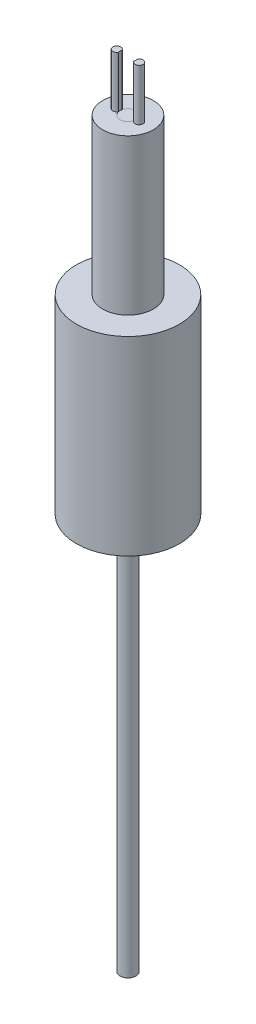
from build123d import *

# Parameters (mm, degrees)
BOSS_EXTRUDE1_DEPTH      = 50.1
BOSS_EXTRUDE1_2_DEPTH    = 50.1
SKETCH1_3_R              = 3.2
BOSS_EXTRUDE2_DEPTH      = 43.6
SKETCH1_4_R              = 6.5
SKETCH1_4_R_2            = 3.2
BOSS_EXTRUDE3_DEPTH      = 24
BOSS_EXTRUDE4_DEPTH      = 43.6
BOSS_EXTRUDE4_DEPTH_BACK = 50
SKETCH1_5_R              = 1


with BuildPart() as part:
    # Sketch1 → Boss-Extrude1 (new body)
    with BuildSketch(Plane(origin=(0, 0, 0), x_dir=(1, 0, 0), z_dir=(0, 1, 0))):
        with BuildLine():
            ThreePointArc((0.96969231, -0.244329336), (1.905929832, 0), (0.96969231, 0.244329336))
            ThreePointArc((0.96969231, 0.244329336), (1, 0), (0.96969231, -0.244329336))
        make_face()
    extrude(amount=BOSS_EXTRUDE1_DEPTH)



with BuildPart() as body_2:
    # Sketch1 → Boss-Extrude1 2 (new body)
    with BuildSketch(Plane(origin=(0, 0, 0), x_dir=(1, 0, 0), z_dir=(0, 1, 0))):
        with BuildLine():
            ThreePointArc((-0.96969231, -0.244329336), (-1, 0), (-0.96969231, 0.244329336))
            ThreePointArc((-0.96969231, 0.244329336), (-1.905929832, 0), (-0.96969231, -0.244329336))
        make_face()
    extrude(amount=BOSS_EXTRUDE1_2_DEPTH)


with BuildPart() as part_1:
    add(part.part)

    add(body_2.part)  # Boss-Extrude2 merges body 2
    # Sketch1<3> → Boss-Extrude2 (add)
    with BuildSketch(Plane(origin=(0, 0, 0), x_dir=(1, 0, 0), z_dir=(0, 1, 0))):
        Circle(SKETCH1_3_R)
        with BuildLine():
            ThreePointArc((0.96969231, 0.244329336), (1.532185998, 0.483796838), (1.905929832, 0))
            ThreePointArc((1.905929832, 0), (1.532185998, -0.483796838), (0.96969231, -0.244329336))
            ThreePointArc((0.96969231, -0.244329336), (0, -1), (-0.96969231, -0.244329336))
            ThreePointArc((-0.96969231, -0.244329336), (-1.905929832, 0), (-0.96969231, 0.244329336))
            ThreePointArc((-0.96969231, 0.244329336), (0, 1), (0.96969231, 0.244329336))
        make_face(mode=Mode.SUBTRACT)
    extrude(amount=BOSS_EXTRUDE2_DEPTH)

    # Sketch1<4> → Boss-Extrude3 (add)
    with BuildSketch(Plane(origin=(0, 0, 0), x_dir=(1, 0, 0), z_dir=(0, 1, 0))):
        Circle(SKETCH1_4_R)
        Circle(SKETCH1_4_R_2, mode=Mode.SUBTRACT)
    extrude(amount=BOSS_EXTRUDE3_DEPTH)


with BuildPart() as body_2_2:
    # Sketch1<5> → Boss-Extrude4 (new, two sides: drawn at the far end of the back side and taken through both)
    with BuildSketch(Plane(origin=(0, 0, 0), x_dir=(1, 0, 0), z_dir=(0, 1, 0)).offset(-BOSS_EXTRUDE4_DEPTH_BACK)):
        Circle(SKETCH1_5_R)
    extrude(amount=BOSS_EXTRUDE4_DEPTH + BOSS_EXTRUDE4_DEPTH_BACK)


solid = Compound([part_1.part, body_2_2.part])
